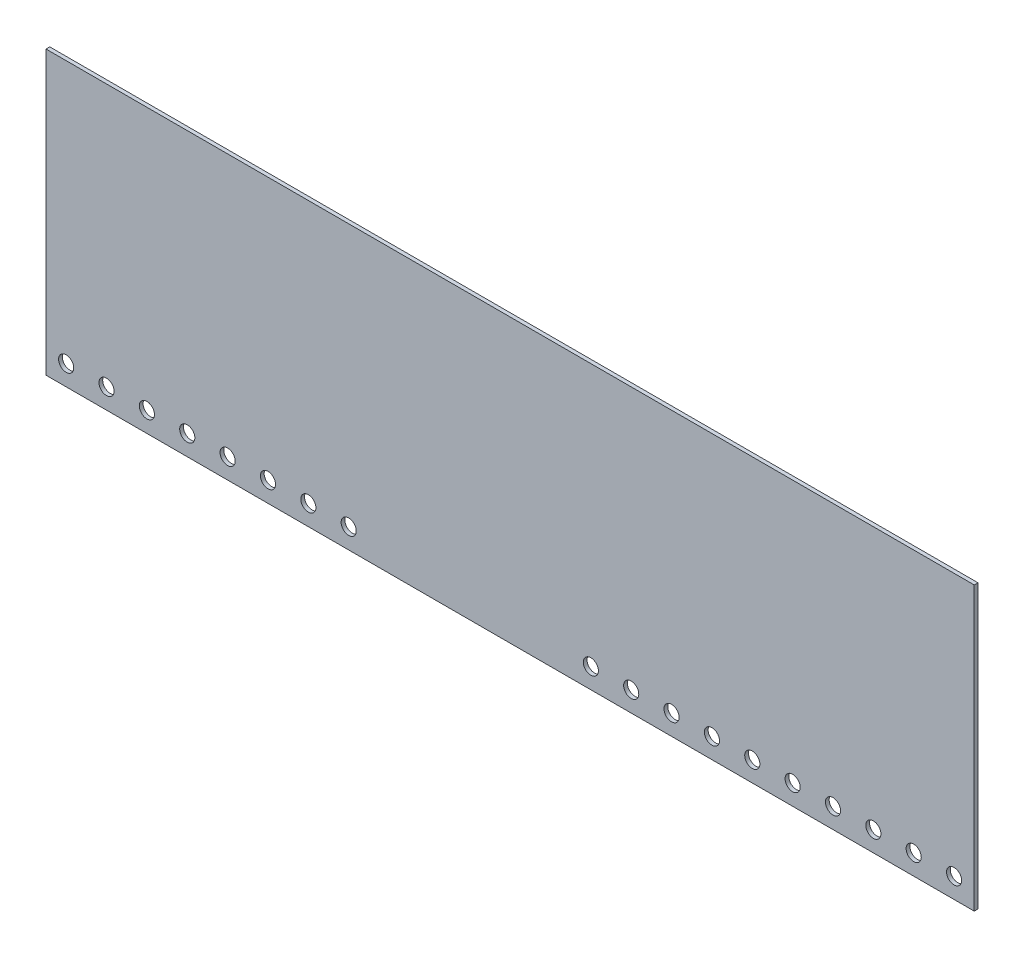
from build123d import *

# Parameters (mm, degrees)
SKETCH1_W           = 584.2
SKETCH1_H           = 177.8
SKETCH1_R           = 4.7625
BOSS_EXTRUDE1_DEPTH = 1.1811


with BuildPart() as part:
    # Sketch1 → Boss-Extrude1 (new, symmetric)
    with BuildSketch(Plane.XY):
        with Locations((-22.079522351, 51.805915244)):
            Rectangle(SKETCH1_W, SKETCH1_H)
        with Locations((-301.479522351, -24.394084756)):
            Circle(SKETCH1_R, mode=Mode.SUBTRACT)
        with Locations((-276.079522351, -24.394084756)):
            Circle(SKETCH1_R, mode=Mode.SUBTRACT)
        with Locations((-250.679522351, -24.394084756)):
            Circle(SKETCH1_R, mode=Mode.SUBTRACT)
        with Locations((-225.279522351, -24.394084756)):
            Circle(SKETCH1_R, mode=Mode.SUBTRACT)
        with Locations((-199.879522351, -24.394084756)):
            Circle(SKETCH1_R, mode=Mode.SUBTRACT)
        with Locations((-174.479522351, -24.394084756)):
            Circle(SKETCH1_R, mode=Mode.SUBTRACT)
        with Locations((-149.079522351, -24.394084756)):
            Circle(SKETCH1_R, mode=Mode.SUBTRACT)
        with Locations((-123.679522351, -24.394084756)):
            Circle(SKETCH1_R, mode=Mode.SUBTRACT)
        with Locations((28.720477649, -24.394084756)):
            Circle(SKETCH1_R, mode=Mode.SUBTRACT)
        with Locations((54.120477649, -24.394084756)):
            Circle(SKETCH1_R, mode=Mode.SUBTRACT)
        with Locations((79.520477649, -24.394084756)):
            Circle(SKETCH1_R, mode=Mode.SUBTRACT)
        with Locations((104.920477649, -24.394084756)):
            Circle(SKETCH1_R, mode=Mode.SUBTRACT)
        with Locations((130.320477649, -24.394084756)):
            Circle(SKETCH1_R, mode=Mode.SUBTRACT)
        with Locations((155.720477649, -24.394084756)):
            Circle(SKETCH1_R, mode=Mode.SUBTRACT)
        with Locations((181.120477649, -24.394084756)):
            Circle(SKETCH1_R, mode=Mode.SUBTRACT)
        with Locations((206.520477649, -24.394084756)):
            Circle(SKETCH1_R, mode=Mode.SUBTRACT)
        with Locations((231.920477649, -24.394084756)):
            Circle(SKETCH1_R, mode=Mode.SUBTRACT)
        with Locations((257.320477649, -24.394084756)):
            Circle(SKETCH1_R, mode=Mode.SUBTRACT)
    extrude(amount=BOSS_EXTRUDE1_DEPTH, both=True)


solid = part.part
